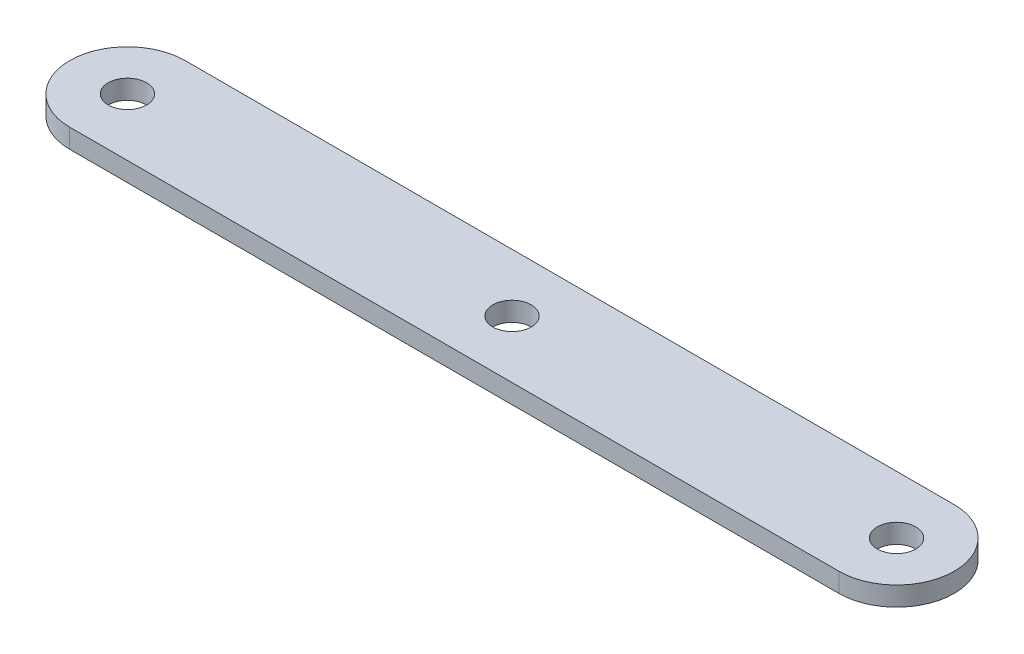
from build123d import *

# Parameters (mm, degrees)
SKETCH_1_R      = 5
EXTRUDE_1_DEPTH = 5


with BuildPart() as part:
    # 草图1 → 凸台-拉伸1 (new body)
    with BuildSketch(Plane(origin=(0, 0, 0), x_dir=(1, 0, 0), z_dir=(0, 1, 0))):
        with BuildLine():
            Line((0, 15), (200, 15))
            ThreePointArc((200, 15), (215, 0), (200, -15))
            Line((200, -15), (0, -15))
            ThreePointArc((0, -15), (-15, 0), (0, 15))
        make_face()
        with Locations(Location((200, 0, 0), (0, 0, 270))):
            Circle(SKETCH_1_R, mode=Mode.SUBTRACT)
        with Locations(Location((100, 0, 0), (0, 0, 270))):
            Circle(SKETCH_1_R, mode=Mode.SUBTRACT)
        with Locations(Location((0, 0, 0), (0, 0, 270))):
            Circle(SKETCH_1_R, mode=Mode.SUBTRACT)
    extrude(amount=EXTRUDE_1_DEPTH)


solid = part.part
